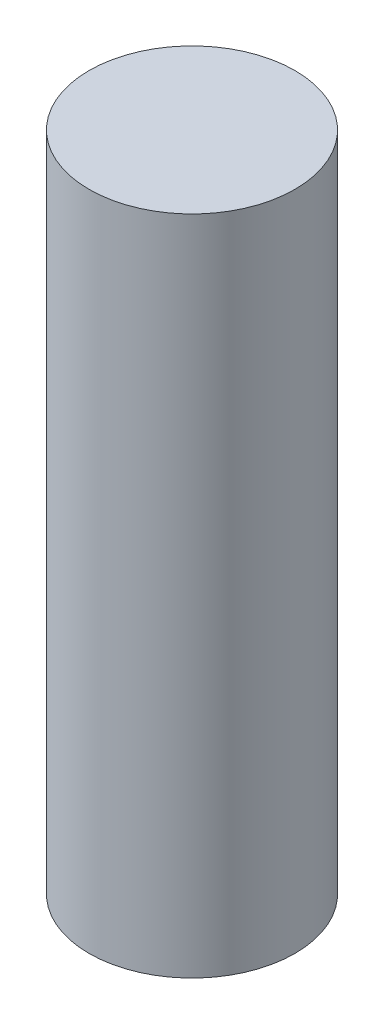
from build123d import *

# Parameters (mm, degrees)
SKETCH_1_R      = 1.4
EXTRUDE_1_DEPTH = 9


with BuildPart() as part:
    # 草图1 → 凸台-拉伸1 (new body)
    with BuildSketch(Plane(origin=(0, 0, 0), x_dir=(1, 0, 0), z_dir=(0, 1, 0))):
        with Locations(Location((0, 0, 0), (0, 0, 270))):
            Circle(SKETCH_1_R)
    extrude(amount=EXTRUDE_1_DEPTH)


solid = part.part
